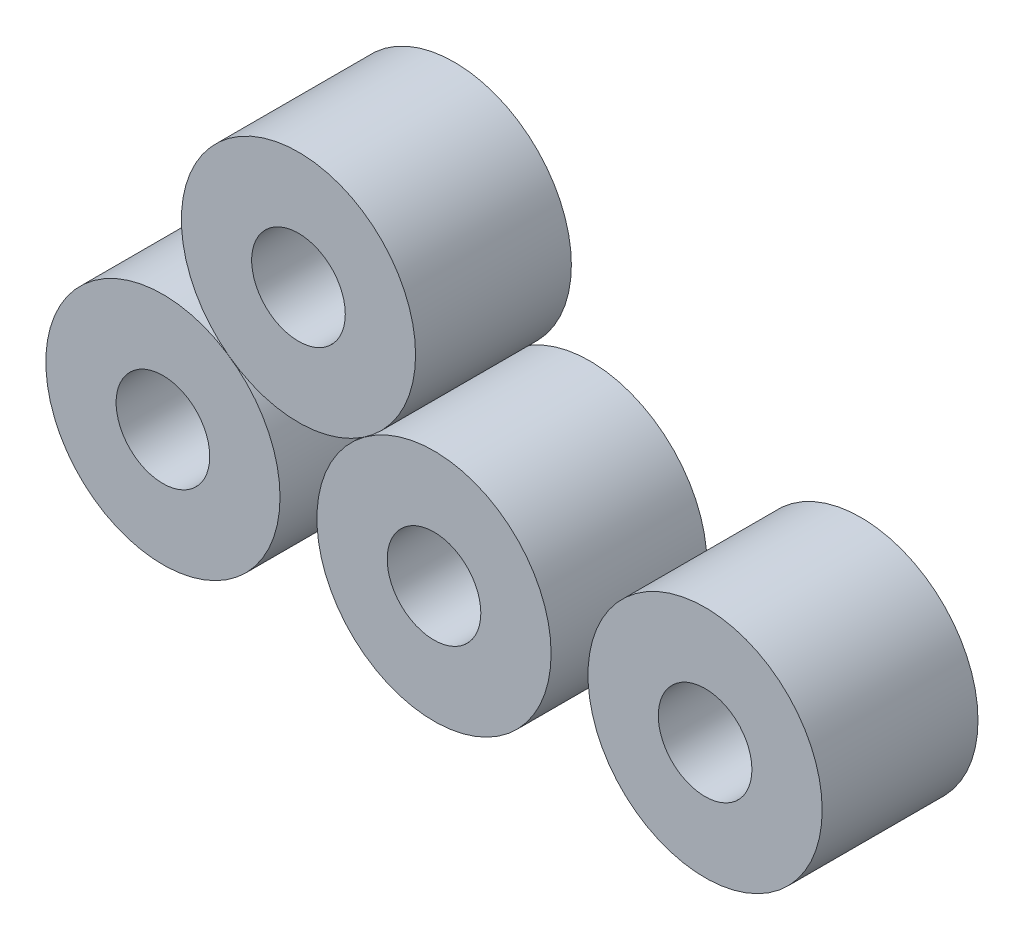
from build123d import *

# Parameters (mm, degrees)
SZKIC1_R                      = 953
SZKIC1_R_2                    = 381
DODANIE_WYCI_GNI_CIE1_DEPTH   = 1268
DODANIE_WYCI_GNI_CIE1_2_DEPTH = 1268
DODANIE_WYCI_GNI_CIE1_3_DEPTH = 1268
DODANIE_WYCI_GNI_CIE1_4_DEPTH = 1268


with BuildPart() as part:
    # Szkic1 → Dodanie-wyciągnięcie1 (new body)
    with BuildSketch(Plane.XY):
        Circle(SZKIC1_R)
        Circle(SZKIC1_R_2, mode=Mode.SUBTRACT)
    extrude(amount=DODANIE_WYCI_GNI_CIE1_DEPTH)


with BuildPart() as body_2:
    # Szkic1 → Dodanie-wyci_gni_cie1 2 (new body)
    with BuildSketch(Plane.XY):
        with Locations((2206, 0)):
            Circle(SZKIC1_R)
        with Locations((2206, 0)):
            Circle(SZKIC1_R_2, mode=Mode.SUBTRACT)
    extrude(amount=DODANIE_WYCI_GNI_CIE1_2_DEPTH)


with BuildPart() as body_3:
    # Szkic1 → Dodanie-wyci_gni_cie1 3 (new body)
    with BuildSketch(Plane.XY):
        with Locations((4412, 0)):
            Circle(SZKIC1_R)
        with Locations((4412, 0)):
            Circle(SZKIC1_R_2, mode=Mode.SUBTRACT)
    extrude(amount=DODANIE_WYCI_GNI_CIE1_3_DEPTH)


with BuildPart() as body_4:
    # Szkic1 → Dodanie-wyci_gni_cie1 4 (new body)
    with BuildSketch(Plane.XY):
        with Locations((1103, 1554.421757439)):
            Circle(SZKIC1_R)
        with Locations((1103, 1554.421757439)):
            Circle(SZKIC1_R_2, mode=Mode.SUBTRACT)
    extrude(amount=DODANIE_WYCI_GNI_CIE1_4_DEPTH)


solid = Compound([part.part, body_2.part, body_3.part, body_4.part])
